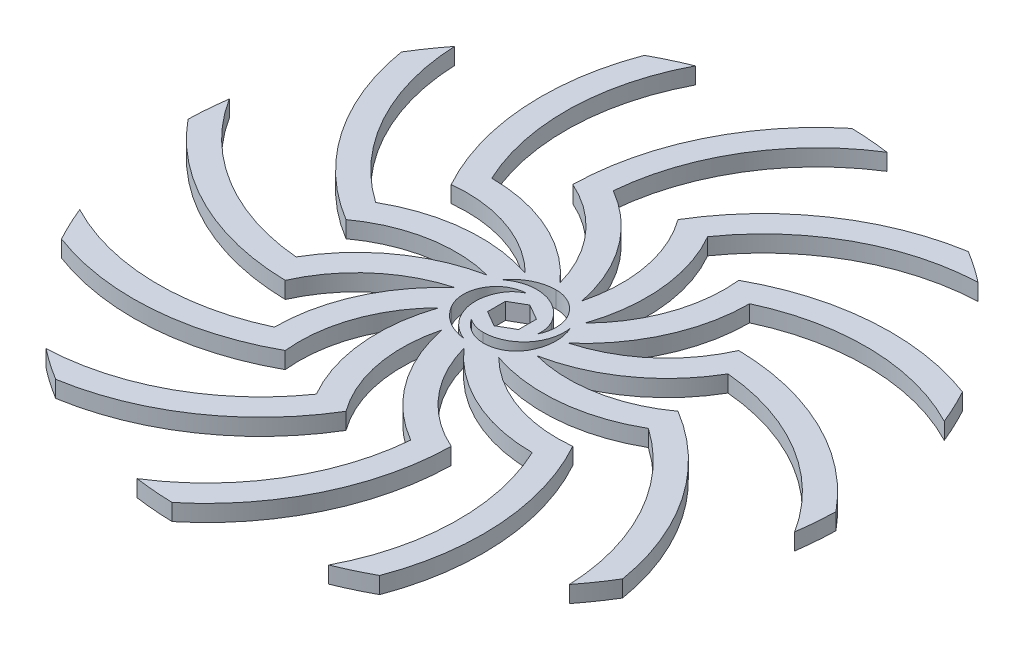
from build123d import *

# Parameters (mm, degrees)
BOSS_EXTRUDE1_DEPTH = 2
CIRPATTERN1_COUNT   = 12
SKETCH2_R           = 6.32456178
BOSS_EXTRUDE2_DEPTH = 2
CUT_EXTRUDE1_DEPTH  = 57.587611293
SCALE1_SCALE        = 3.4
CUT_EXTRUDE2_DEPTH  = 6.8


with BuildPart() as part:
    # Sketch1 → Boss-Extrude1 (new body)
    with BuildSketch(Plane(origin=(0, 0, 0), x_dir=(1, 0, 0), z_dir=(0, 1, 0))):
        with BuildLine():
            ThreePointArc((0, 20), (3.252272915, 10), (0, 0))
            Line((0, 0), (3.572780991, 0))
            ThreePointArc((3.572780991, 0), (6.252272915, 10), (3.572780991, 20))
            ThreePointArc((3.572780991, 20), (12.742280623, 28.230711371), (24.614013417, 31.530149754))
            ThreePointArc((24.614013417, 31.530149754), (22.757477342, 32.895246238), (20.825411836, 34.151167211))
            ThreePointArc((20.825411836, 34.151167211), (8.856268151, 29.366098374), (0, 20))
        make_face()
    extrude(amount=BOSS_EXTRUDE1_DEPTH)


with BuildPart() as cirpattern1_1:
    # CirPattern1: pattern copy
    add(part.part.rotate(Axis((0, 0, 0), (0, 1, 0)), 1 * 360 / CIRPATTERN1_COUNT))


with BuildPart() as cirpattern1_2:
    # CirPattern1: pattern copy
    add(part.part.rotate(Axis((0, 0, 0), (0, 1, 0)), 2 * 360 / CIRPATTERN1_COUNT))


with BuildPart() as cirpattern1_3:
    # CirPattern1: pattern copy
    add(part.part.rotate(Axis((0, 0, 0), (0, 1, 0)), 3 * 360 / CIRPATTERN1_COUNT))


with BuildPart() as cirpattern1_4:
    # CirPattern1: pattern copy
    add(part.part.rotate(Axis((0, 0, 0), (0, 1, 0)), 4 * 360 / CIRPATTERN1_COUNT))


with BuildPart() as cirpattern1_5:
    # CirPattern1: pattern copy
    add(part.part.rotate(Axis((0, 0, 0), (0, 1, 0)), 5 * 360 / CIRPATTERN1_COUNT))


with BuildPart() as cirpattern1_6:
    # CirPattern1: pattern copy
    add(part.part.rotate(Axis((0, 0, 0), (0, 1, 0)), 6 * 360 / CIRPATTERN1_COUNT))


with BuildPart() as cirpattern1_7:
    # CirPattern1: pattern copy
    add(part.part.rotate(Axis((0, 0, 0), (0, 1, 0)), 7 * 360 / CIRPATTERN1_COUNT))


with BuildPart() as cirpattern1_8:
    # CirPattern1: pattern copy
    add(part.part.rotate(Axis((0, 0, 0), (0, 1, 0)), 8 * 360 / CIRPATTERN1_COUNT))


with BuildPart() as cirpattern1_9:
    # CirPattern1: pattern copy
    add(part.part.rotate(Axis((0, 0, 0), (0, 1, 0)), 9 * 360 / CIRPATTERN1_COUNT))


with BuildPart() as cirpattern1_10:
    # CirPattern1: pattern copy
    add(part.part.rotate(Axis((0, 0, 0), (0, 1, 0)), 10 * 360 / CIRPATTERN1_COUNT))


with BuildPart() as cirpattern1_11:
    # CirPattern1: pattern copy
    add(part.part.rotate(Axis((0, 0, 0), (0, 1, 0)), 11 * 360 / CIRPATTERN1_COUNT))


with BuildPart() as part_1:
    add(part.part)

    add(cirpattern1_1.part)  # Boss-Extrude2 merges CirPattern1_1

    add(cirpattern1_2.part)  # Boss-Extrude2 merges CirPattern1_2

    add(cirpattern1_3.part)  # Boss-Extrude2 merges CirPattern1_3

    add(cirpattern1_4.part)  # Boss-Extrude2 merges CirPattern1_4

    add(cirpattern1_5.part)  # Boss-Extrude2 merges CirPattern1_5

    add(cirpattern1_6.part)  # Boss-Extrude2 merges CirPattern1_6

    add(cirpattern1_7.part)  # Boss-Extrude2 merges CirPattern1_7

    add(cirpattern1_8.part)  # Boss-Extrude2 merges CirPattern1_8

    add(cirpattern1_9.part)  # Boss-Extrude2 merges CirPattern1_9

    add(cirpattern1_10.part)  # Boss-Extrude2 merges CirPattern1_10

    add(cirpattern1_11.part)  # Boss-Extrude2 merges CirPattern1_11
    # Sketch2 → Boss-Extrude2 (add)
    with BuildSketch(Plane(origin=(0, 0, 0), x_dir=(1, 0, 0), z_dir=(0, 1, 0))):
        Circle(SKETCH2_R)
    extrude(amount=BOSS_EXTRUDE2_DEPTH)

    # Sketch3 → Cut-Extrude1 (cut, through all)
    with BuildSketch(Plane(origin=(0, 2, 0), x_dir=(1, 0, 0), z_dir=(0, 1, 0))):
        with BuildLine():
            ThreePointArc((-0.518779192, -5.29922884), (-3.404124769, -2.355249802), (-3.031088913, 1.75))
            ThreePointArc((-3.031088913, 1.75), (-2.338245241, 2.604344292), (-1.414452319, 3.201456643))
            ThreePointArc((-1.414452319, 3.201456643), (-4.658051165, 1.166519136), (-4.611205766, -2.66228089))
            ThreePointArc((-4.611205766, -2.66228089), (-2.884018037, -4.47586842), (-0.518779192, -5.29922884))
        make_face()
        with BuildLine():
            ThreePointArc((3.5, 0), (3.494938576, -0.188160443), (3.479768941, -0.375776681))
            ThreePointArc((3.479768941, -0.375776681), (3.339260789, 3.450731073), (0, 5.32456178))
            ThreePointArc((0, 5.32456178), (-2.434206737, 4.735567095), (-4.3298772, 3.098890379))
            ThreePointArc((-4.3298772, 3.098890379), (-0.337643776, 4.125683429), (3.031088913, 1.75))
            ThreePointArc((3.031088913, 1.75), (3.380740392, 0.905866658), (3.5, 0))
        make_face()
        with BuildLine():
            ThreePointArc((0, -3.5), (-1.086305696, -3.327151925), (-2.065316622, -2.825679962))
            ThreePointArc((-2.065316622, -2.825679962), (1.318790377, -4.617250209), (4.611205766, -2.66228089))
            ThreePointArc((4.611205766, -2.66228089), (5.143131737, -1.378097996), (5.32456178, 0))
            ThreePointArc((5.32456178, 0), (5.204225623, 1.1256082), (4.848656392, 2.200338461))
            ThreePointArc((4.848656392, 2.200338461), (3.741768545, -1.770433627), (0, -3.5))
        make_face()
    extrude(amount=-CUT_EXTRUDE1_DEPTH, mode=Mode.SUBTRACT)


with BuildPart() as part_2:
    # Scale1: scaled about (0, 1, 0)
    add(part_1.part.scale(SCALE1_SCALE).moved(Location((0, -2.4, 0))))

    # Sketch4 → Cut-Extrude2 (cut)
    with BuildSketch(Plane(origin=(0, 4.4, 0), x_dir=(1, 0, 0), z_dir=(0, 1, 0))):
        Polygon((0, 7.332348419), (-6.35, 3.666174209), (-6.35, -3.666174209), (0, -7.332348419), (6.35, -3.666174209), (6.35, 3.666174209), align=None)
    extrude(amount=-CUT_EXTRUDE2_DEPTH, mode=Mode.SUBTRACT)


solid = part_2.part
